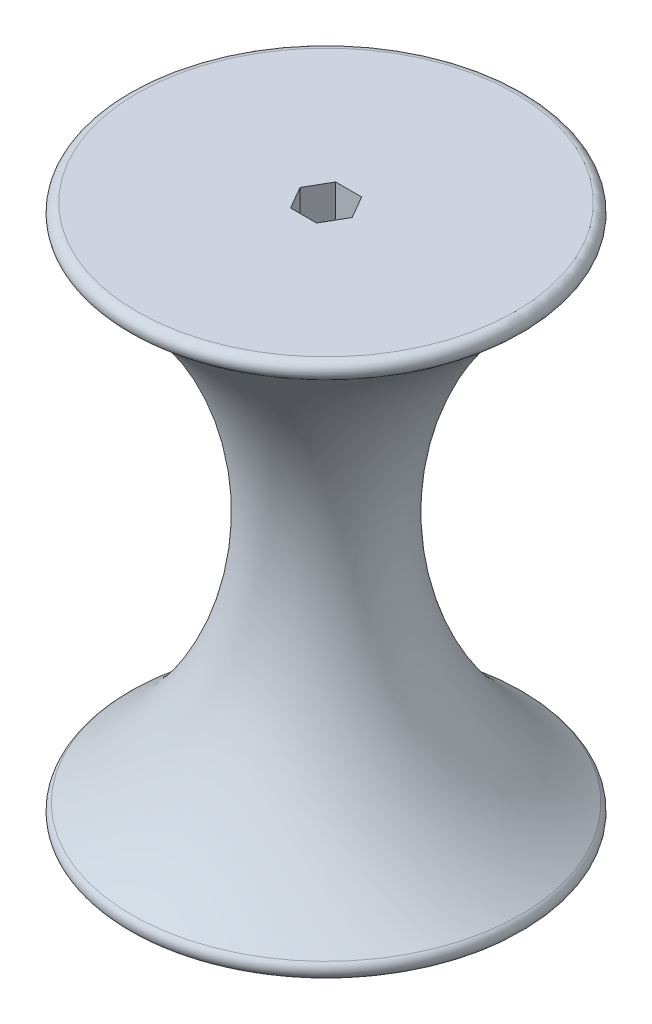
from build123d import *

# Parameters (mm, degrees)
CUT_EXTRUDE1_DEPTH = 172.951680952


with BuildPart() as part:
    # Sketch1 → Revolve1 (revolve)
    with BuildSketch(Plane.XY, mode=Mode.PRIVATE) as revolve1_sk:
        with BuildLine():
            Line((0, -76.2), (53.76994832, -76.2))
            ThreePointArc((53.76994832, -76.2), (56.183319637, -74.451984147), (55.274949756, -71.613888889))
            ThreePointArc((55.274949756, -71.613888889), (19.05, 0), (55.274949756, 71.613888889))
            ThreePointArc((55.274949756, 71.613888889), (56.183319637, 74.451984147), (53.76994832, 76.2))
            Line((53.76994832, 76.2), (0, 76.2))
            Line((0, 76.2), (0, -76.2))
        make_face()
    revolve(revolve1_sk.sketch.rotate(Axis((0, -76.2, 0), (0, 1, 0)), 90), axis=Axis((0, -76.2, 0), (0, 1, 0)))

    # Sketch3 → Cut-Extrude1 (cut, through all)
    with BuildSketch(Plane(origin=(0, 76.2, 0), x_dir=(1, 0, 0), z_dir=(0, 1, 0))):
        Polygon((7.405671903, 0), (3.702835951, -6.4135), (-3.702835951, -6.4135), (-7.405671903, 0), (-3.702835951, 6.4135), (3.702835951, 6.4135), align=None)
    extrude(amount=-CUT_EXTRUDE1_DEPTH, mode=Mode.SUBTRACT)


solid = part.part
